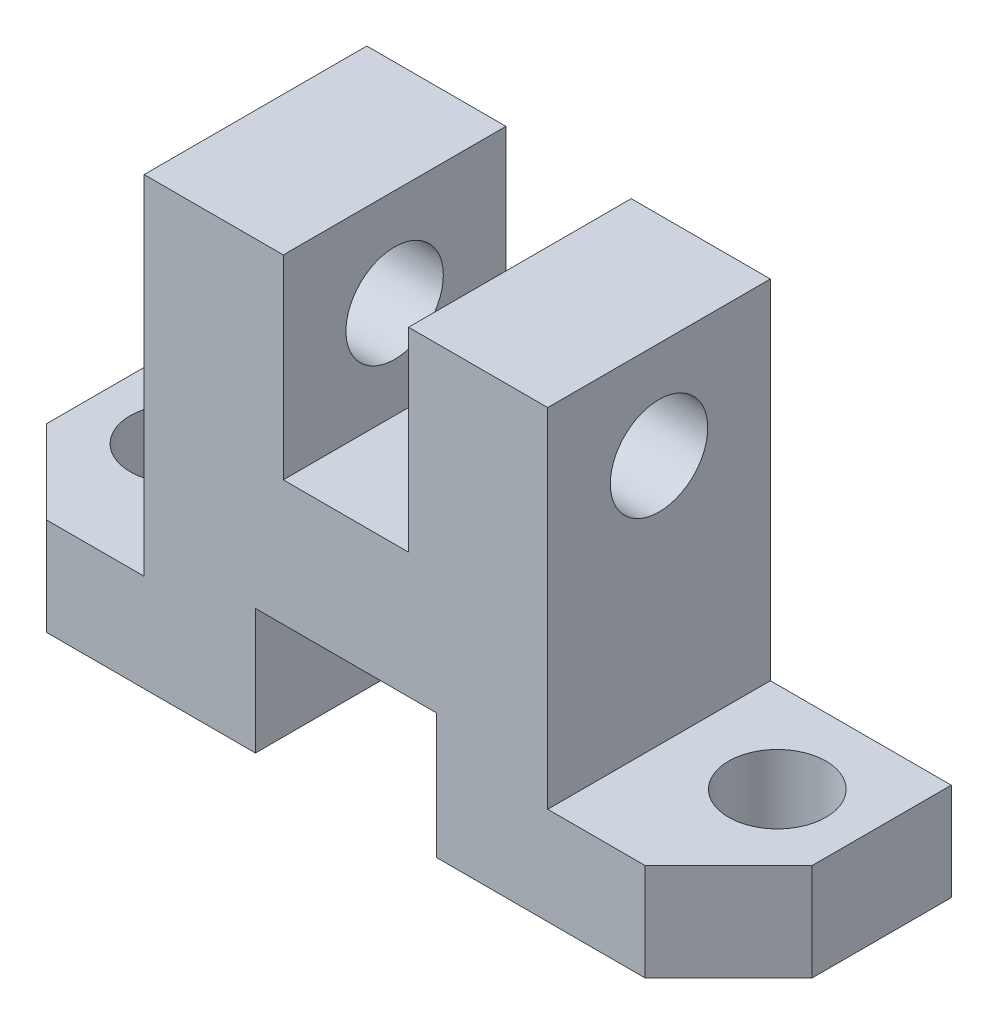
from build123d import *

# Parameters (mm, degrees)
BOSS_EXTRUDE1_DEPTH     = 16
CUT_EXTRUDE1_DEPTH      = 49.414873748
CUT_EXTRUDE1_DEPTH_BACK = 49.414873748
SKETCH2_R               = 3.5
CHAMFER1_SIZE           = 6
CHAMFER2_SIZE           = 6
CUT_EXTRUDE2_DEPTH      = 41.462946012
CUT_EXTRUDE2_DEPTH_BACK = 16
SKETCH6_R               = 3.5
SKETCH6_3_R             = 3.5
CUT_EXTRUDE3_DEPTH      = 16


with BuildPart() as part:
    # Sketch1 → Boss-Extrude1 (new body)
    with BuildSketch(Plane.XY):
        Polygon((4.5, 0), (-4.5, 0), (-4.5, 14), (-14.5, 14), (-14.5, -11), (-27.5, -11), (-27.5, -18), (-6.5, -18), (-6.5, -9), (6.5, -9), (6.5, -18), (27.5, -18), (27.5, -11), (14.5, -11), (14.5, 14), (4.5, 14), align=None)
    extrude(amount=-BOSS_EXTRUDE1_DEPTH)

    # Sketch2 → Cut-Extrude1 (cut, two sides: drawn at the far end of the back side and taken through both)
    with BuildSketch(Plane(origin=(14.5, 0, 0), x_dir=(0, 0, -1), z_dir=(1, 0, 0)).offset(-CUT_EXTRUDE1_DEPTH_BACK)):
        with Locations((8, 7)):
            Circle(SKETCH2_R)
    extrude(amount=CUT_EXTRUDE1_DEPTH + CUT_EXTRUDE1_DEPTH_BACK, mode=Mode.SUBTRACT)

    # Chamfer1
    chamfer1_edges = [part.edges().sort_by_distance(p)[0] for p in [
        (-27.5, -14.5, 0),
    ]]
    chamfer(chamfer1_edges, length=CHAMFER1_SIZE)

    # Chamfer2
    chamfer2_edges = [part.edges().sort_by_distance(p)[0] for p in [
        (27.5, -14.5, 0),
    ]]
    chamfer(chamfer2_edges, length=CHAMFER2_SIZE)

    # Sketch6 → Cut-Extrude2 (cut, two sides: drawn at the far end of the back side and taken through both)
    with BuildSketch(Plane(origin=(0, -11, 0), x_dir=(1, 0, 0), z_dir=(0, 1, 0)).offset(-CUT_EXTRUDE2_DEPTH_BACK)):
        with Locations((-21.5, 9.5)):
            Circle(SKETCH6_R)
    extrude(amount=CUT_EXTRUDE2_DEPTH + CUT_EXTRUDE2_DEPTH_BACK, mode=Mode.SUBTRACT)

    # Sketch6<3> → Cut-Extrude3 (cut)
    with BuildSketch(Plane(origin=(0, -11, 0), x_dir=(1, 0, 0), z_dir=(0, 1, 0))):
        with Locations((21.5, 9.5)):
            Circle(SKETCH6_3_R)
    extrude(amount=-CUT_EXTRUDE3_DEPTH, mode=Mode.SUBTRACT)


solid = part.part
